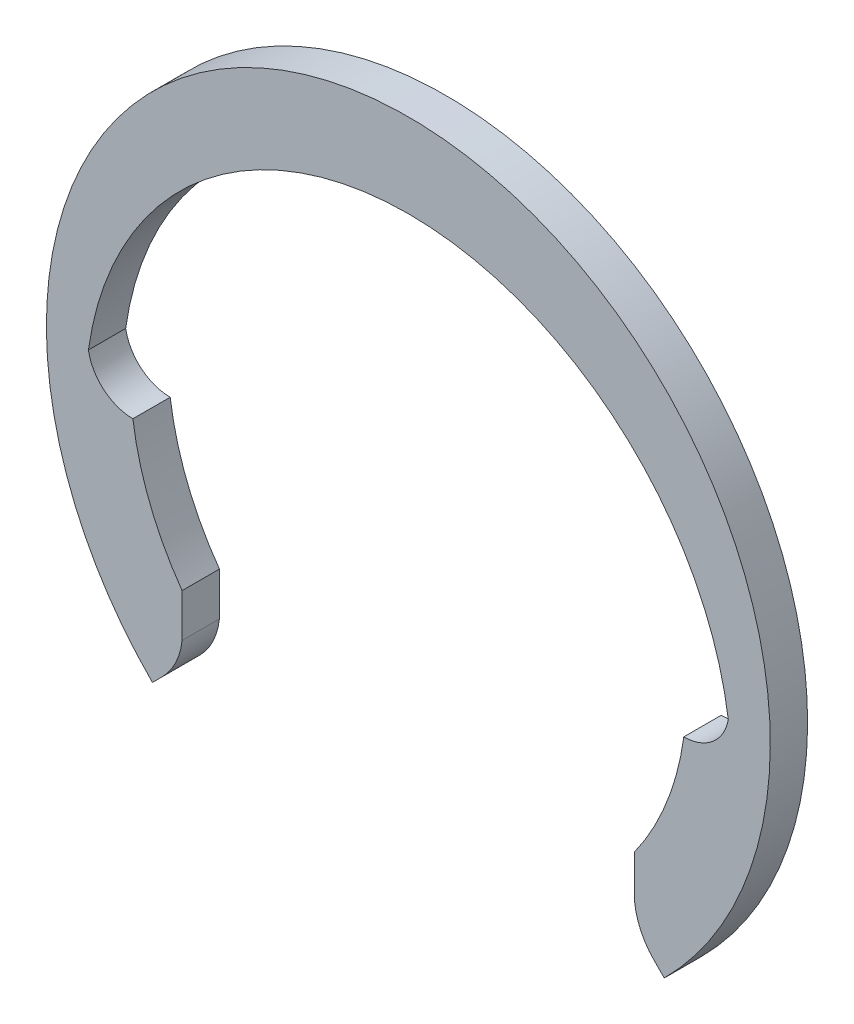
from build123d import *

# Parameters (mm, degrees)
BOSS_EXTRUDE1_DEPTH = 1


with BuildPart() as part:
    # Sketch2 → Boss-Extrude1 (new body)
    with BuildSketch(Plane.XY):
        with BuildLine():
            Line((-6.063440649, -5.485176201), (-6.063440649, -4.906911754))
            Line((-6.063440649, -4.906911754), (-6.063440649, -4.328647306))
            ThreePointArc((-6.063440649, -4.328647306), (-6.925954574, -2.744750124), (-7.38258085, -1))
            ThreePointArc((-7.38258085, -1), (-8.160697716, -0.716909737), (-8.575, 0))
            ThreePointArc((-8.575, 0), (0, 7.45), (8.575, 0))
            ThreePointArc((8.575, 0), (8.160697716, -0.716909737), (7.38258085, -1))
            ThreePointArc((7.38258085, -1), (6.925954574, -2.744750124), (6.063440649, -4.328647306))
            Line((6.063440649, -4.328647306), (6.063440649, -4.906911754))
            Line((6.063440649, -4.906911754), (6.063440649, -5.485176201))
            ThreePointArc((6.063440649, -5.485176201), (6.23368639, -6.084881018), (6.593770735, -6.593770735))
            Line((6.593770735, -6.593770735), (6.858935778, -6.858935778))
            ThreePointArc((6.858935778, -6.858935778), (0, 9.7), (-6.858935778, -6.858935778))
            Line((-6.858935778, -6.858935778), (-6.593770735, -6.593770735))
            ThreePointArc((-6.593770735, -6.593770735), (-6.23368639, -6.084881018), (-6.063440649, -5.485176201))
        make_face()
    extrude(amount=BOSS_EXTRUDE1_DEPTH)


solid = part.part
